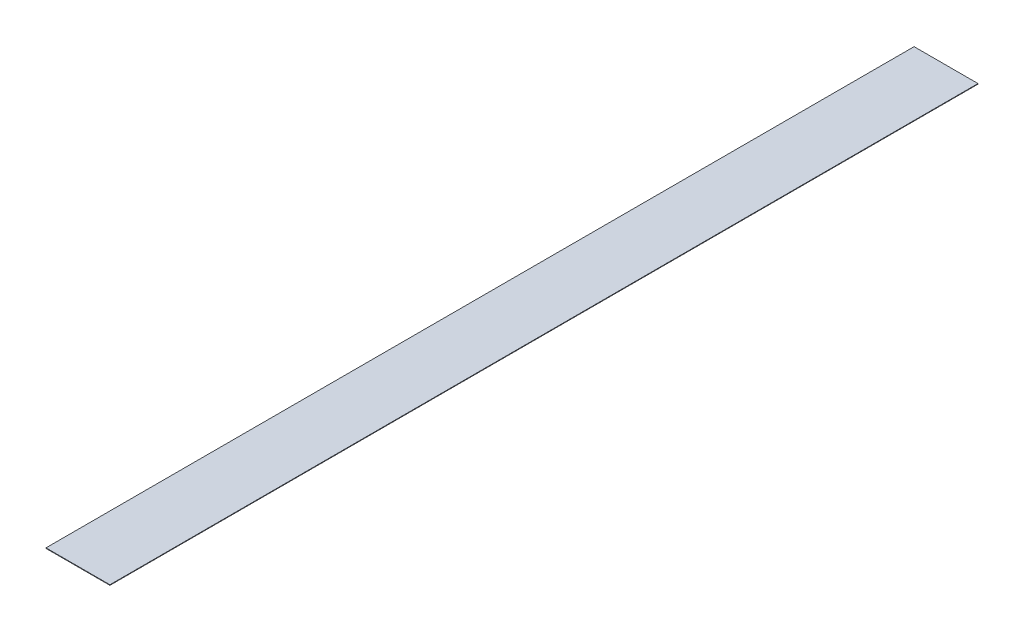
from build123d import *

# Parameters (mm, degrees)
ESQUISSE1_W        = 1200
ESQUISSE1_H        = 16300
BOSS_EXTRU_1_DEPTH = 10


with BuildPart() as part:
    # Esquisse1 → Boss.-Extru.1 (new body)
    with BuildSketch(Plane(origin=(0, 0, 0), x_dir=(1, 0, 0), z_dir=(0, 1, 0))):
        Rectangle(ESQUISSE1_W, ESQUISSE1_H)
    extrude(amount=BOSS_EXTRU_1_DEPTH)


solid = part.part
